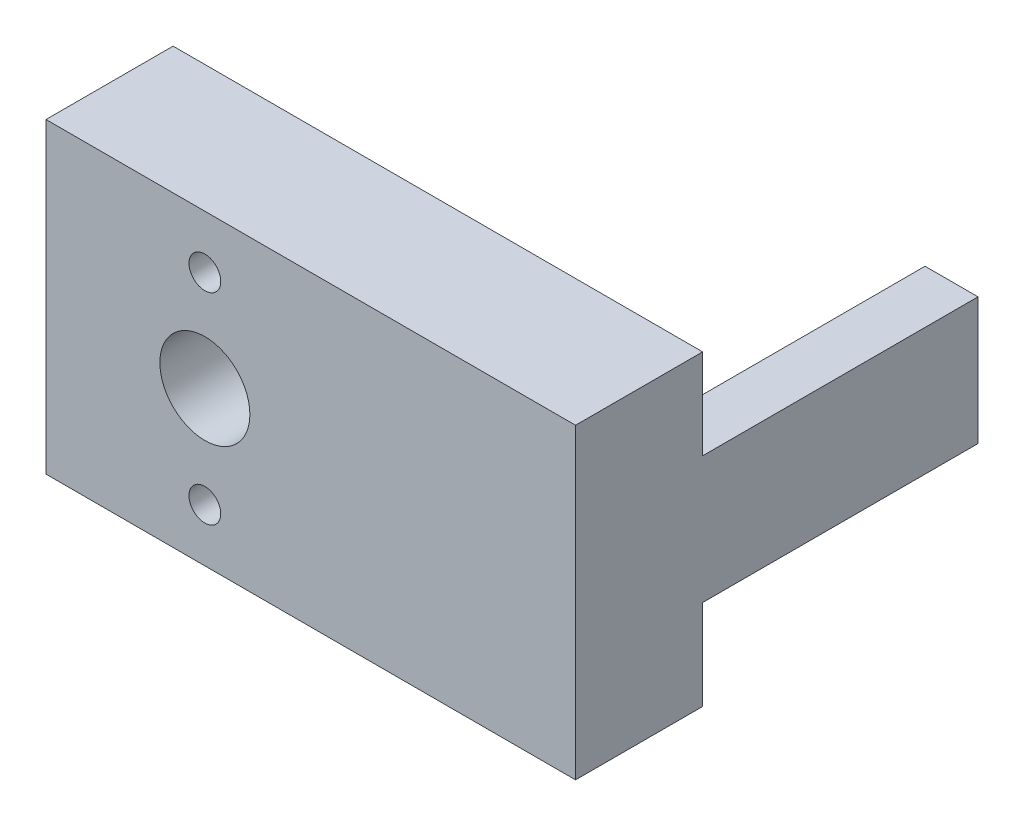
from build123d import *

# Parameters (mm, degrees)
SKETCH1_W           = 50
SKETCH1_H           = 29
BOSS_EXTRUDE1_DEPTH = 12
SKETCH2_R           = 4.25
CUT_EXTRUDE1_DEPTH  = 12
SKETCH6_R           = 1.5
CUT_EXTRUDE2_DEPTH  = 12
SKETCH3_W           = 5
SKETCH3_H           = 12
BOSS_EXTRUDE2_DEPTH = 26


with BuildPart() as part:
    # Sketch1 → Boss-Extrude1 (new body)
    with BuildSketch(Plane.XY):
        with Locations((-2.5, 0)):
            Rectangle(SKETCH1_W, SKETCH1_H)
    extrude(amount=BOSS_EXTRUDE1_DEPTH)

    # Sketch2 → Cut-Extrude1 (cut)
    with BuildSketch(Plane.XY.offset(12)):
        with Locations((-12.5, 0)):
            Circle(SKETCH2_R)
    extrude(amount=-CUT_EXTRUDE1_DEPTH, mode=Mode.SUBTRACT)

    # Sketch6 → Cut-Extrude2 (cut)
    with BuildSketch(Plane.XY.offset(12)):
        with Locations((-12.5, 9.5)):
            Circle(SKETCH6_R)
        with Locations((-12.5, -9.5)):
            Circle(SKETCH6_R)
    extrude(amount=-CUT_EXTRUDE2_DEPTH, mode=Mode.SUBTRACT)

    # Sketch3 → Boss-Extrude2 (add)
    with BuildSketch(Plane(origin=(0, 0, 0), x_dir=(-1, 0, 0), z_dir=(0, 0, -1))):
        with Locations((-20, 0)):
            Rectangle(SKETCH3_W, SKETCH3_H)
    extrude(amount=BOSS_EXTRUDE2_DEPTH)


solid = part.part
